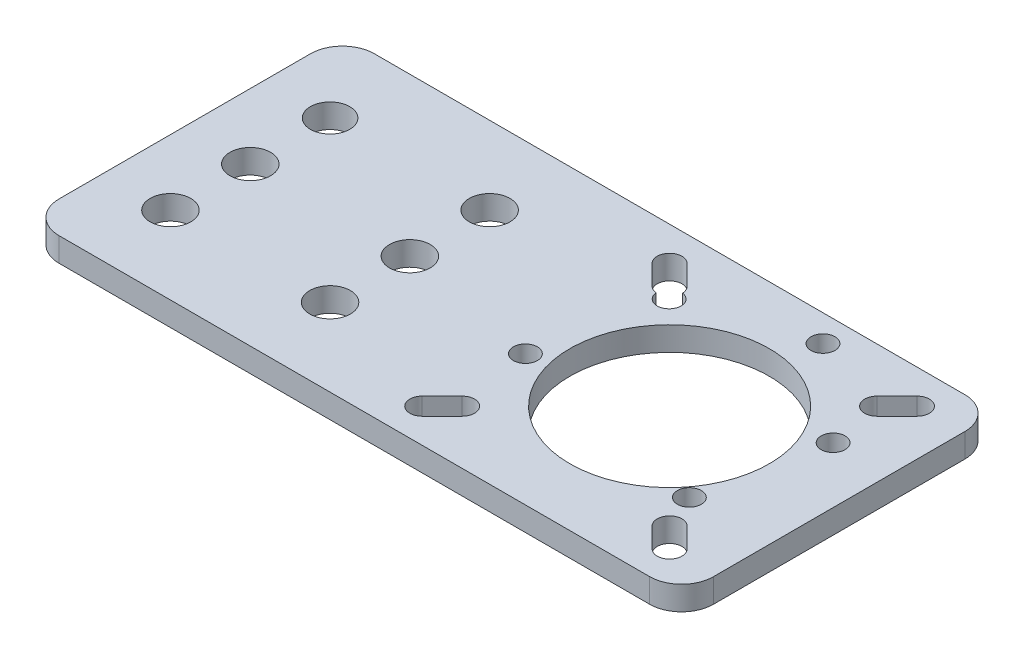
from build123d import *

# Parameters (mm, degrees)
SKETCH1_R           = 2.55
SKETCH1_R_2         = 1.5
SKETCH1_R_3         = 12.5
SKETCH1_R_4         = 2.466704156
BOSS_EXTRUDE1_DEPTH = 3


with BuildPart() as part:
    # Sketch1 → Boss-Extrude1 (new body)
    with BuildSketch(Plane(origin=(0, 0, 0), x_dir=(1, 0, 0), z_dir=(0, 1, 0))):
        with BuildLine():
            Line((57.086176903, 28.881843054), (-16.913823097, 28.881843054))
            ThreePointArc((-16.913823097, 28.881843054), (-19.742250221, 27.710270179), (-20.913823097, 24.881843054))
            Line((-20.913823097, 24.881843054), (-20.913823097, -6.618156946))
            ThreePointArc((-20.913823097, -6.618156946), (-19.742250221, -9.44658407), (-16.913823097, -10.618156946))
            Line((-16.913823097, -10.618156946), (57.086176903, -10.618156946))
            ThreePointArc((57.086176903, -10.618156946), (59.914604028, -9.44658407), (61.086176903, -6.618156946))
            Line((61.086176903, -6.618156946), (61.086176903, 24.881843054))
            ThreePointArc((61.086176903, 24.881843054), (59.914604028, 27.710270179), (57.086176903, 28.881843054))
        make_face()
        with Locations(Location((-12.713823097, -0.868156946, 0), (0, 0, 270))):
            Circle(SKETCH1_R, mode=Mode.SUBTRACT)
        with Locations(Location((7.286176903, -0.868156946, 0), (0, 0, 270))):
            Circle(SKETCH1_R, mode=Mode.SUBTRACT)
        with Locations(Location((-12.713823097, 9.131843054, 0), (0, 0, 270))):
            Circle(SKETCH1_R, mode=Mode.SUBTRACT)
        with Locations(Location((7.286176903, 9.131843054, 0), (0, 0, 270))):
            Circle(SKETCH1_R, mode=Mode.SUBTRACT)
        with BuildLine():
            Line((27.932192414, -4.964172457), (25.432192414, -7.464172457))
            ThreePointArc((25.432192414, -7.464172457), (23.240161393, -7.464172457), (23.240161393, -5.272141435))
            Line((23.240161393, -5.272141435), (25.740161393, -2.772141435))
            ThreePointArc((25.740161393, -2.772141435), (27.932192414, -2.772141435), (27.932192414, -4.964172457))
        make_face(mode=Mode.SUBTRACT)
        with BuildLine():
            Line((53.932192414, -2.772141435), (56.432192414, -5.272141435))
            ThreePointArc((56.432192414, -5.272141435), (56.432192414, -7.464172457), (54.240161393, -7.464172457))
            Line((54.240161393, -7.464172457), (51.740161393, -4.964172457))
            ThreePointArc((51.740161393, -4.964172457), (51.740161393, -2.772141435), (53.932192414, -2.772141435))
        make_face(mode=Mode.SUBTRACT)
        with Locations(Location((25.105765127, 5.791209645, 0), (0, 0, 270))):
            Circle(SKETCH1_R_2, mode=Mode.SUBTRACT)
        with Locations(Location((39.836176903, 9.131843054, 0), (0, 0, 270))):
            Circle(SKETCH1_R_3, mode=Mode.SUBTRACT)
        with Locations(Location((50.977423293, 0.467225819, 0), (0, 0, 270))):
            Circle(SKETCH1_R_2, mode=Mode.SUBTRACT)
        with Locations(Location((-12.713823097, 19.131843054, 0), (0, 0, 270))):
            Circle(SKETCH1_R_4, mode=Mode.SUBTRACT)
        with Locations(Location((7.286176903, 19.131843054, 0), (0, 0, 270))):
            Circle(SKETCH1_R, mode=Mode.SUBTRACT)
        with Locations(Location((54.051226788, 15.404234625, 0), (0, 0, 270))):
            Circle(SKETCH1_R_2, mode=Mode.SUBTRACT)
        with BuildLine():
            Line((25.740161393, 21.035827543), (23.240161393, 23.535827543))
            ThreePointArc((23.240161393, 23.535827543), (23.240161393, 25.727858565), (25.432192414, 25.727858565))
            Line((25.432192414, 25.727858565), (27.932192414, 23.227858565))
            ThreePointArc((27.932192414, 23.227858565), (28.251915532, 22.762861387), (28.383986105, 22.214224337))
            ThreePointArc((28.383986105, 22.214224337), (29.31019372, 21.713960247), (29.679568623, 20.728218451))
            ThreePointArc((29.679568623, 20.728218451), (28.24918667, 19.22983488), (26.686030853, 20.5891324))
            ThreePointArc((26.686030853, 20.5891324), (26.174275251, 20.730277429), (25.740161393, 21.035827543))
        make_face(mode=Mode.SUBTRACT)
        with BuildLine():
            ThreePointArc((54.240161393, 25.727858565), (56.432192414, 25.727858565), (56.432192414, 23.535827543))
            Line((56.432192414, 23.535827543), (53.932192414, 21.035827543))
            ThreePointArc((53.932192414, 21.035827543), (51.740161393, 21.035827543), (51.740161393, 23.227858565))
            Line((51.740161393, 23.227858565), (54.240161393, 25.727858565))
        make_face(mode=Mode.SUBTRACT)
        with Locations(Location((42.652299453, 25.534730941, 0), (0, 0, 270))):
            Circle(SKETCH1_R_2, mode=Mode.SUBTRACT)
    extrude(amount=BOSS_EXTRUDE1_DEPTH)


solid = part.part
